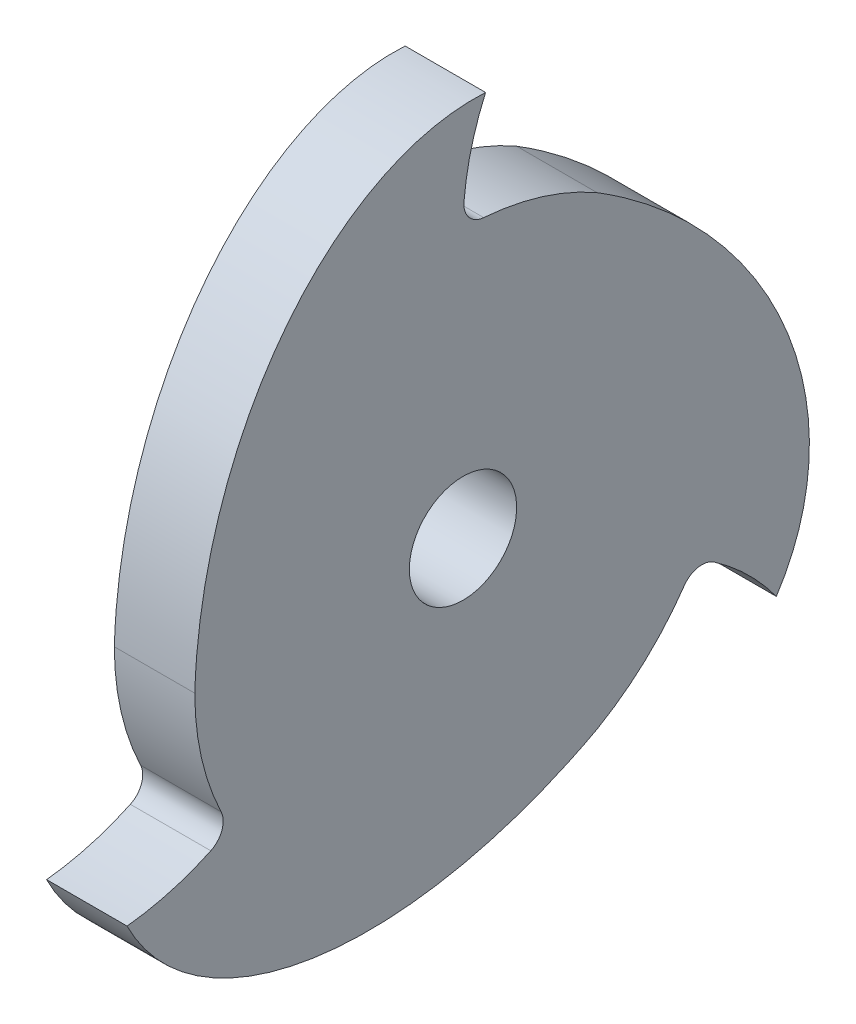
from build123d import *

# Parameters (mm, degrees)
SKETCH1_R           = 6.35
BOSS_EXTRUDE3_DEPTH = 9.525
FILLET3_R           = 2.54


with BuildPart() as part:
    # Sketch1 → Boss-Extrude3 (new body)
    # profile 1 of 4: a face of its own
    with BuildSketch(Plane(origin=(0, 0, 0), x_dir=(0, 0, -1), z_dir=(1, 0, 0))):
        with BuildLine():
            ThreePointArc((-31.520099492, 3.813899322), (-21.059097755, 23.760827043), (0, 31.75))
            ThreePointArc((0, 31.75), (0.675988504, 38.199887052), (2.67457554, 44.369461859))
            add(Edge.make_bspline(
                [(2.67457554, 44.369461859), (-27.656863026, 46.197830298), (-31.520099492, 3.813899322)],
                knots=[3.141592654, 3.141592654, 3.141592654, 4.660979846, 4.660979846, 4.660979846], degree=2, weights=[1, 0.709776495, 0.966045781]))
        make_face()
    # profile 2 of 4: a face of its own
    with BuildSketch(Plane(origin=(0, 0, 0), x_dir=(0, 0, -1), z_dir=(1, 0, 0))):
        with BuildLine():
            add(Edge.make_bspline(
                [(19.062983446, 25.390257228), (17.50131988, 26.492217898), (15.875, 27.49630657)],
                knots=[1.519387193, 1.519387193, 1.519387193, 1.613788447, 1.613788447, 1.613788447], degree=2, weights=[0.966045781, 0.981968084, 1]))
            ThreePointArc((15.875, 27.49630657), (8.217504682, 30.668144985), (0, 31.75))
            ThreePointArc((0, 31.75), (-21.059097755, 23.760827043), (-31.520099492, 3.813899322))
            add(Edge.make_bspline(
                [(-31.520099492, 3.813899322), (-31.693593642, 1.910478667), (-31.75, 0)],
                knots=[4.660979846, 4.660979846, 4.660979846, 4.7553811, 4.7553811, 4.7553811], degree=2, weights=[0.966045781, 0.981968084, 1]))
            ThreePointArc((-31.75, 0), (-30.668144985, -8.217504682), (-27.49630657, -15.875))
            ThreePointArc((-27.49630657, -15.875), (-10.047930956, -30.118127158), (12.457116045, -29.204156551))
            add(Edge.make_bspline(
                [(12.457116045, -29.204156551), (14.192273762, -28.402696564), (15.875, -27.49630657)],
                knots=[1.519387193, 1.519387193, 1.519387193, 1.613788447, 1.613788447, 1.613788447], degree=2, weights=[0.966045781, 0.981968084, 1]))
            ThreePointArc((15.875, -27.49630657), (22.450640303, -22.450640303), (27.49630657, -15.875))
            ThreePointArc((27.49630657, -15.875), (30.668144985, -8.217504682), (31.75, 0))
            ThreePointArc((31.75, 0), (28.401692066, 14.191771834), (19.062983446, 25.390257228))
        make_face()
        with Locations(Location((0, 0, 0), (0, 0, 180))):
            Circle(SKETCH1_R, mode=Mode.SUBTRACT)
    # profile 3 of 4: a face of its own
    with BuildSketch(Plane(origin=(0, 0, 0), x_dir=(0, 0, -1), z_dir=(1, 0, 0))):
        with BuildLine():
            add(Edge.make_bspline(
                [(37.087793352, -24.500981292), (53.836926151, 0.852630821), (19.062983446, 25.390257228)],
                knots=[0, 0, 0, 1.519387193, 1.519387193, 1.519387193], degree=2, weights=[1, 0.709776495, 0.966045781]))
            ThreePointArc((19.062983446, 25.390257228), (28.401692066, 14.191771834), (31.75, 0))
            ThreePointArc((31.75, 0), (30.668144985, -8.217504682), (27.49630657, -15.875))
            ThreePointArc((27.49630657, -15.875), (32.744078357, -19.685366743), (37.087793352, -24.500981292))
        make_face()
    # profile 4 of 4: a face of its own
    with BuildSketch(Plane(origin=(0, 0, 0), x_dir=(0, 0, -1), z_dir=(1, 0, 0))):
        with BuildLine():
            ThreePointArc((-27.49630657, -15.875), (-33.420066861, -18.514520309), (-39.762368892, -19.868480568))
            add(Edge.make_bspline(
                [(-39.762368892, -19.868480568), (-26.180063124, -47.050461119), (12.457116045, -29.204156551)],
                knots=[0, 0, 0, 1.519387193, 1.519387193, 1.519387193], degree=2, weights=[1, 0.709776495, 0.966045781]))
            ThreePointArc((12.457116045, -29.204156551), (-10.047930956, -30.118127158), (-27.49630657, -15.875))
        make_face()
    extrude(amount=BOSS_EXTRUDE3_DEPTH)

    # Fillet3
    fillet3_edges = [part.edges().sort_by_distance(p)[0] for p in [
        (4.7625, 31.75, 0),
        (4.7625, -15.875, -27.49630657),
        (4.7625, -15.875, 27.49630657),
    ]]
    fillet(fillet3_edges, radius=FILLET3_R)


solid = part.part
